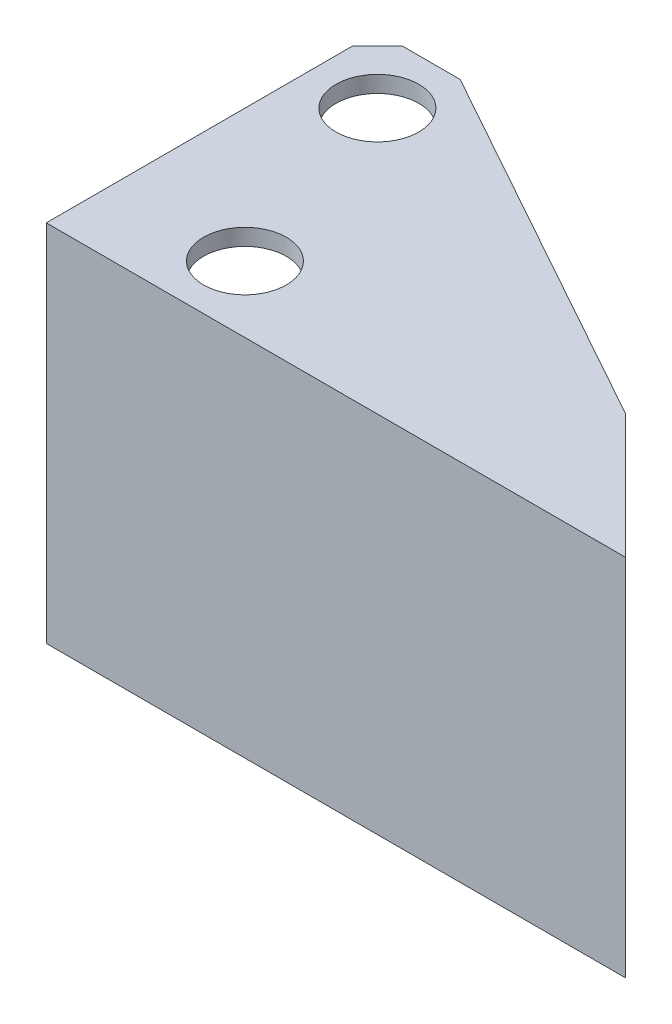
from build123d import *

# Parameters (mm, degrees)
SKETCH4_W           = 70
SKETCH4_H           = 40
BOSS_EXTRUDE3_DEPTH = 44
SKETCH5_W           = 38
SKETCH5_H           = 40
CUT_EXTRUDE5_DEPTH  = 92.847700026
CUT_EXTRUDE8_DEPTH  = 92.847700026
CHAMFER2_SIZE       = 3
SKETCH9_R           = 5
CUT_EXTRUDE9_DEPTH  = 92.847700026


with BuildPart() as part:
    # Sketch4 → Boss-Extrude3 (new body)
    with BuildSketch(Plane(origin=(0, 0, 0), x_dir=(1, 0, 0), z_dir=(0, 1, 0))):
        with Locations((35, 20)):
            Rectangle(SKETCH4_W, SKETCH4_H)
    extrude(amount=BOSS_EXTRUDE3_DEPTH)

    # Sketch5 → Cut-Extrude5 (cut, through all)
    with BuildSketch(Plane.ZY):
        with Locations((-21, 22)):
            Rectangle(SKETCH5_W, SKETCH5_H)
    extrude(amount=-CUT_EXTRUDE5_DEPTH, mode=Mode.SUBTRACT)

    # Sketch8 → Cut-Extrude8 (cut, through all)
    with BuildSketch(Plane(origin=(0, 44, 0), x_dir=(1, 0, 0), z_dir=(0, 1, 0))):
        Polygon((10, 40), (55, 15), (70, 0), (70, 40), align=None)
    extrude(amount=-CUT_EXTRUDE8_DEPTH, mode=Mode.SUBTRACT)

    # Chamfer2
    chamfer2_edges = [part.edges().sort_by_distance(p)[0] for p in [
        (0, 1, -40),
        (0, 43, -40),
    ]]
    chamfer(chamfer2_edges, length=CHAMFER2_SIZE)

    # Sketch9 → Cut-Extrude9 (cut, through all)
    with BuildSketch(Plane(origin=(0, 44, 0), x_dir=(1, 0, 0), z_dir=(0, 1, 0))):
        with Locations(Location((8, 32, 0), (0, 0, 270))):
            Circle(SKETCH9_R)
        with Locations(Location((16, 8, 0), (0, 0, 270))):
            Circle(SKETCH9_R)
    extrude(amount=-CUT_EXTRUDE9_DEPTH, mode=Mode.SUBTRACT)


solid = part.part
